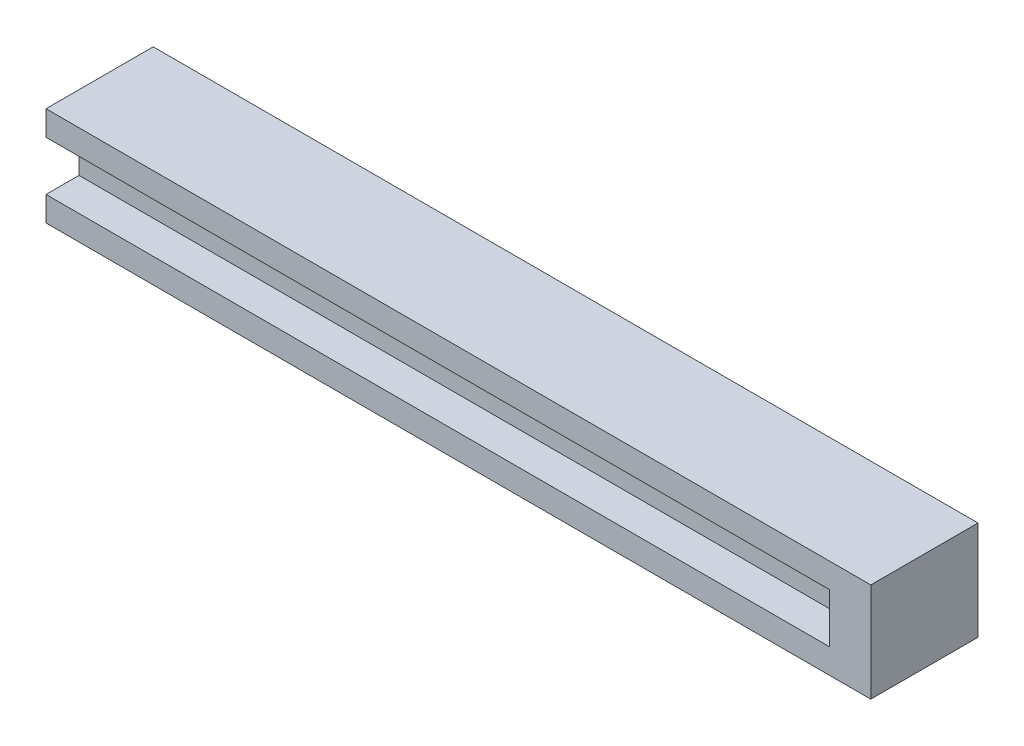
from build123d import *

# Parameters (mm, degrees)
ESQUISSE1_W        = 100
ESQUISSE1_H        = 12
BOSS_EXTRU_1_DEPTH = 5
BOSS_EXTRU_2_DEPTH = 4
BOSS_EXTRU_3_DEPTH = 4


with BuildPart() as part:
    # Esquisse1 → Boss.-Extru.1 (new body)
    with BuildSketch(Plane.XY):
        Rectangle(ESQUISSE1_W, ESQUISSE1_H)
    extrude(amount=BOSS_EXTRU_1_DEPTH)

    # Esquisse2 → Boss.-Extru.2 (add)
    with BuildSketch(Plane.XY.offset(5)):
        Polygon((-50, 3), (45, 3), (45, -3), (-50, -3), (-50, -6), (50, -6), (50, 6), (-50, 6), align=None)
    extrude(amount=BOSS_EXTRU_2_DEPTH)

    # Esquisse3 → Boss.-Extru.3 (add)
    with BuildSketch(Plane(origin=(0, 0, 0), x_dir=(-1, 0, 0), z_dir=(0, 0, -1))):
        Polygon((-50, -6), (50, -6), (50, -3), (-45, -3), (-45, 3), (50, 3), (50, 6), (-50, 6), align=None)
    extrude(amount=BOSS_EXTRU_3_DEPTH)


solid = part.part
